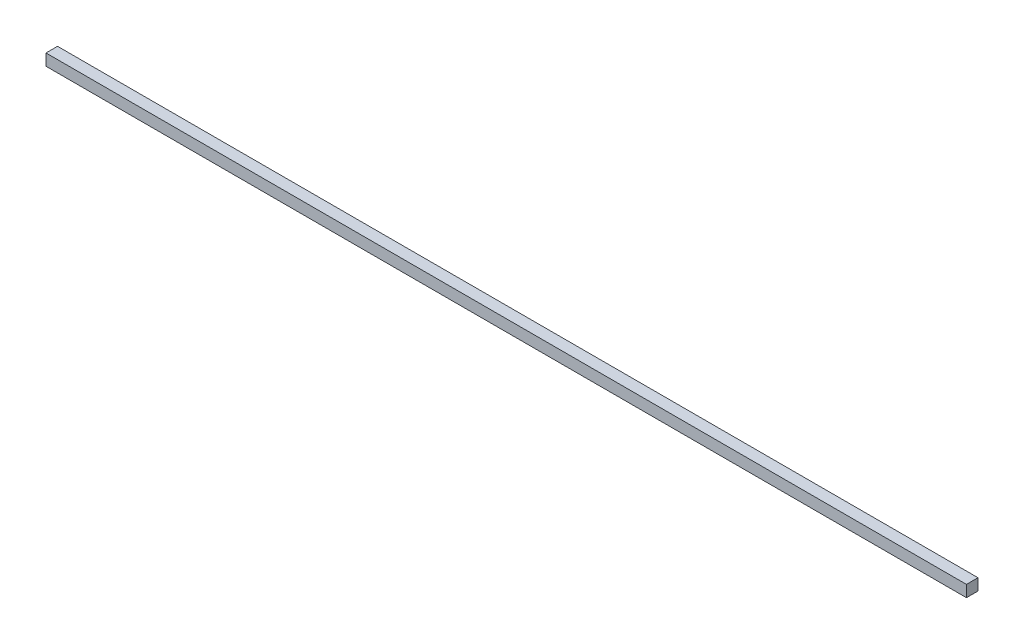
from build123d import *

# Parameters (mm, degrees)
SKETCH1_W                                = 638
SKETCH1_H                                = 8
STORE_KLAPE_KASET_KATI_PIVOT_MIL_1_DEPTH = 8


with BuildPart() as part:
    # Sketch1 → STORE_klape_kaset_kati_pivot_mil_1 (new body)
    with BuildSketch(Plane.XY):
        with Locations((378, 412)):
            Rectangle(SKETCH1_W, SKETCH1_H)
    extrude(amount=-STORE_KLAPE_KASET_KATI_PIVOT_MIL_1_DEPTH)


solid = part.part
